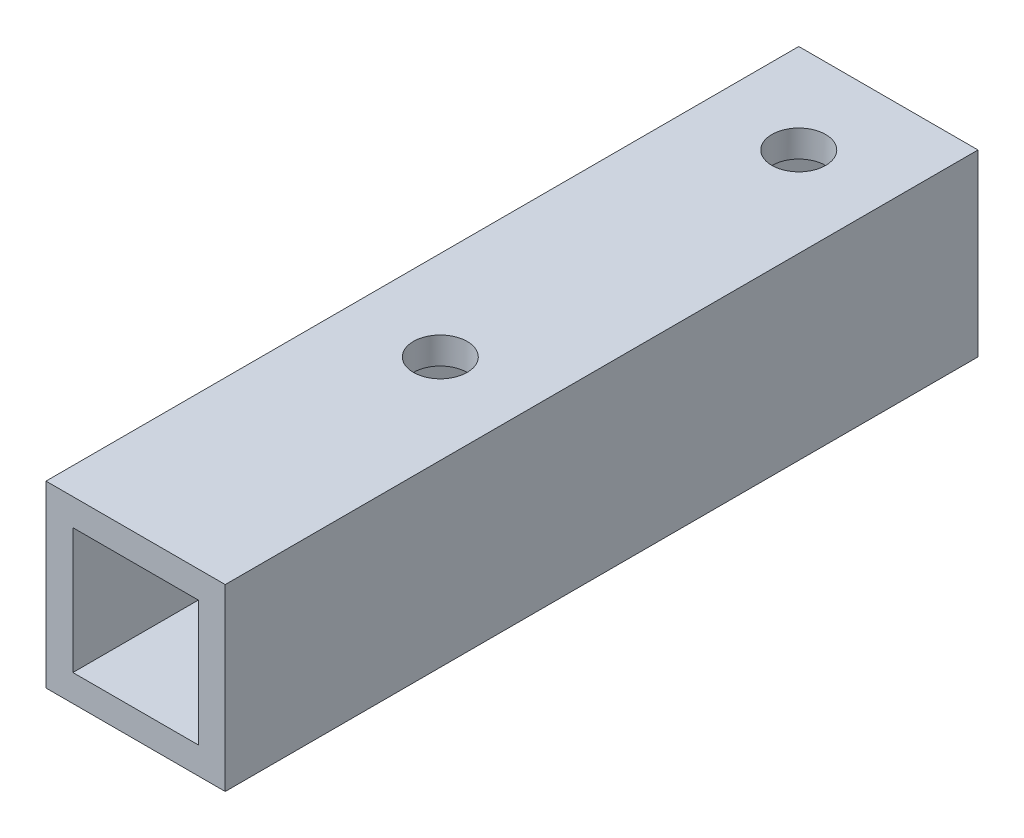
from build123d import *

# Parameters (mm, degrees)
SKETCH_1_W          = 10
SKETCH_1_H          = 10
SKETCH_1_W_2        = 7
SKETCH_1_H_2        = 7
EXTRUDE_1_DEPTH     = 42
SKETCH_2_R          = 1.5
CUT_EXTRUDE_1_DEPTH = 44.462627624


with BuildPart() as part:
    # ｽｹｯﾁ1 → 押し出し-薄板1 (new body)
    with BuildSketch(Plane.XY):
        Rectangle(SKETCH_1_W, SKETCH_1_H)
        Rectangle(SKETCH_1_W_2, SKETCH_1_H_2, mode=Mode.SUBTRACT)
    extrude(amount=EXTRUDE_1_DEPTH)

    # ｽｹｯﾁ2 → ｶｯﾄ - 押し出し1 (cut, through all)
    with BuildSketch(Plane(origin=(0, 5, 0), x_dir=(1, 0, 0), z_dir=(0, 1, 0))):
        with Locations(Location((0, -5, 0), (0, 0, 270))):
            Circle(SKETCH_2_R)
        with Locations(Location((0, -25, 0), (0, 0, 270))):
            Circle(SKETCH_2_R)
    extrude(amount=-CUT_EXTRUDE_1_DEPTH, mode=Mode.SUBTRACT)


solid = part.part
